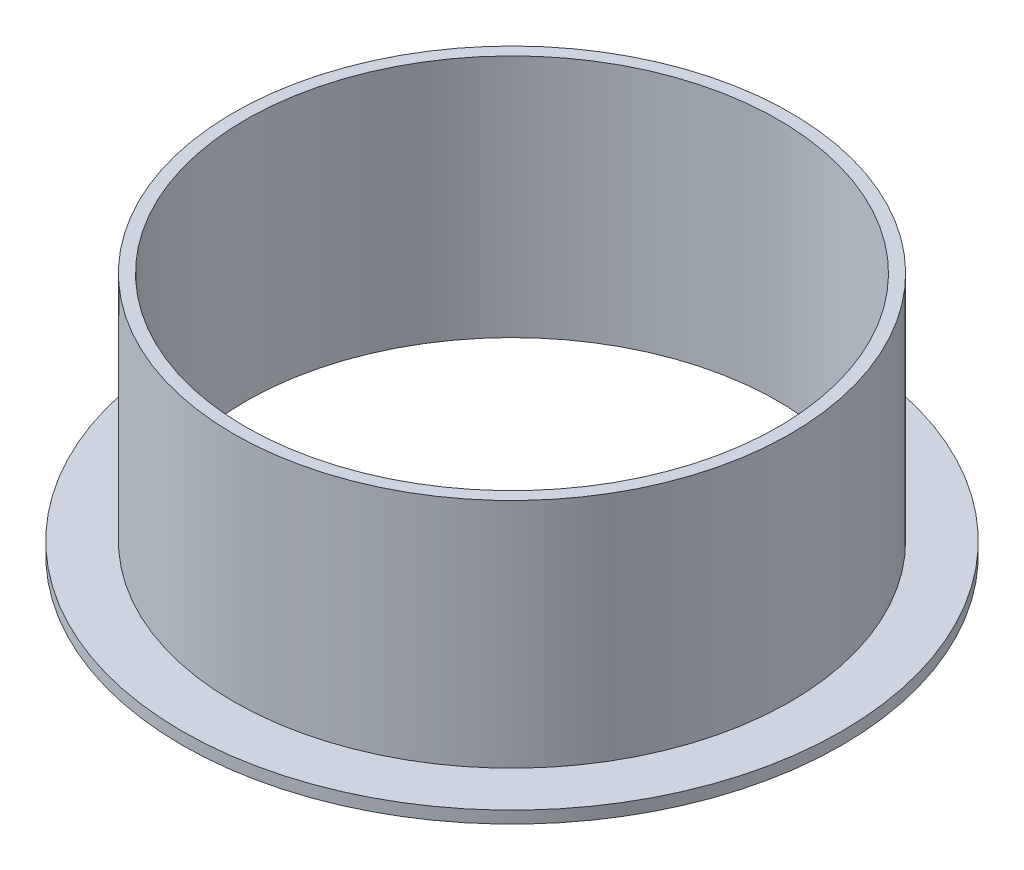
from build123d import *

# Parameters (mm, degrees)
SKETCH1_R           = 73.025
SKETCH1_R_2         = 69.85
BOSS_EXTRUDE1_DEPTH = 64
SKETCH1_3_R         = 86.5
SKETCH1_3_R_2       = 73.025
BOSS_EXTRUDE2_DEPTH = 3.175


with BuildPart() as part:
    # Sketch1 → Boss-Extrude1 (new body)
    with BuildSketch(Plane(origin=(0, 0, 0), x_dir=(1, 0, 0), z_dir=(0, 1, 0))):
        Circle(SKETCH1_R)
        Circle(SKETCH1_R_2, mode=Mode.SUBTRACT)
    extrude(amount=BOSS_EXTRUDE1_DEPTH)

    # Sketch1<3> → Boss-Extrude2 (add)
    with BuildSketch(Plane(origin=(0, 0, 0), x_dir=(1, 0, 0), z_dir=(0, 1, 0))):
        Circle(SKETCH1_3_R)
        Circle(SKETCH1_3_R_2, mode=Mode.SUBTRACT)
    extrude(amount=BOSS_EXTRUDE2_DEPTH)


solid = part.part
